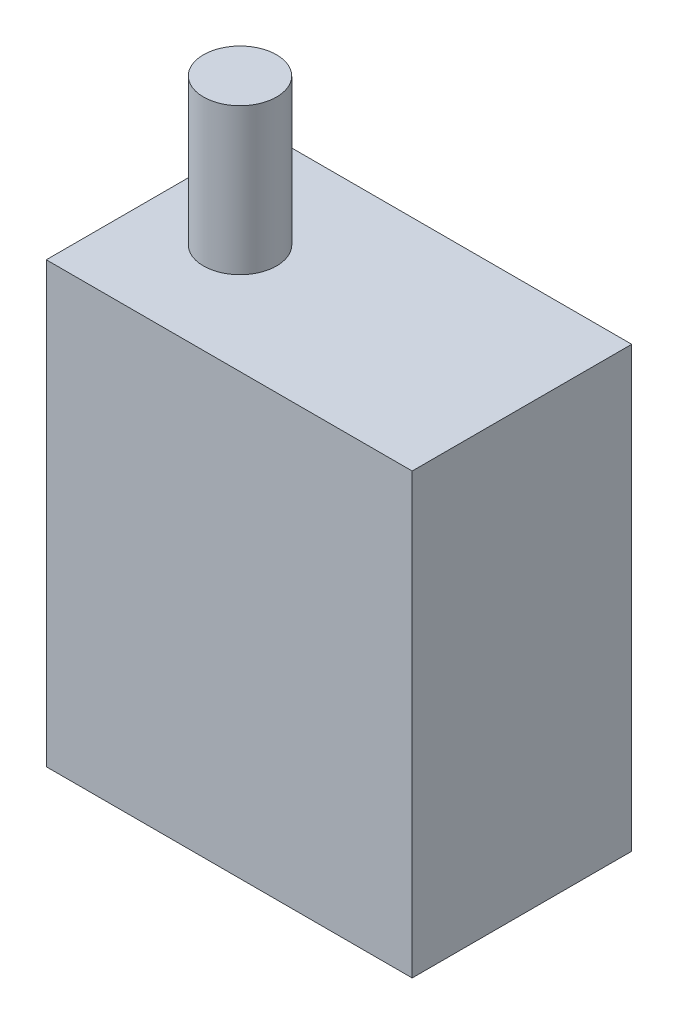
from build123d import *

# Parameters (mm, degrees)
SKETCH1_W           = 25
SKETCH1_H           = 15
BOSS_EXTRUDE1_DEPTH = 30
SKETCH2_R           = 2.5
BOSS_EXTRUDE2_DEPTH = 10


with BuildPart() as part:
    # Sketch1 → Boss-Extrude1 (new body)
    with BuildSketch(Plane(origin=(0, 0, 0), x_dir=(1, 0, 0), z_dir=(0, 1, 0))):
        with Locations((-12.5, 7.5)):
            Rectangle(SKETCH1_W, SKETCH1_H)
    extrude(amount=BOSS_EXTRUDE1_DEPTH)

    # Sketch2 → Boss-Extrude2 (add)
    with BuildSketch(Plane(origin=(0, 30, 0), x_dir=(1, 0, 0), z_dir=(0, 1, 0))):
        with Locations(Location((-19.263188092, 7.5, 0), (0, 0, 270))):
            Circle(SKETCH2_R)
    extrude(amount=BOSS_EXTRUDE2_DEPTH)


solid = part.part
